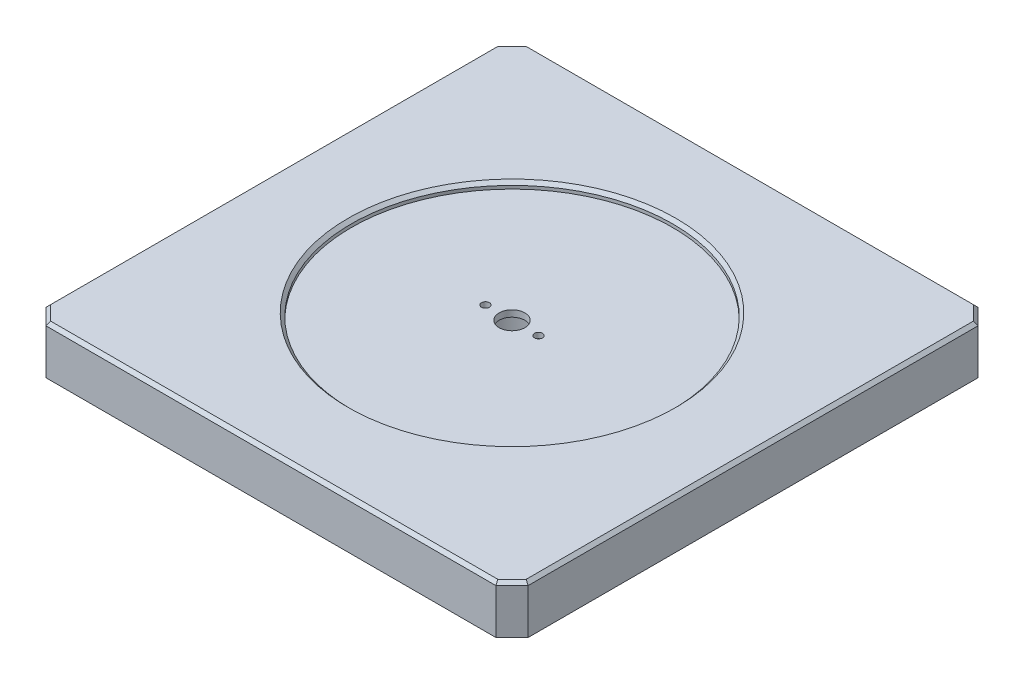
from build123d import *

# Parameters (mm, degrees)
SKETCH1_W                   = 150
SKETCH1_H                   = 150
BOSS_EXTRUDE1_DEPTH         = 15
SKETCH2_R                   = 12.5
CUT_EXTRUDE1_DEPTH          = 11
SKETCH3_R                   = 4
CUT_EXTRUDE2_DEPTH          = 107.6348911
SKETCH4_R                   = 50
CUT_EXTRUDE3_DEPTH          = 2
M3_TAPPED_HOLE1_D           = 2.5
M3_TAPPED_HOLE1_DEPTH       = 7.5
M3_TAPPED_HOLE1_CSINK_D     = 3.05
M3_TAPPED_HOLE1_CSINK_ANGLE = 90
M3_TAPPED_HOLE1_TIP         = 0.751075774
CHAMFER2_SIZE               = 5
CHAMFER1_SIZE               = 1


with BuildPart() as part:
    # Sketch1 → Boss-Extrude1 (new body)
    with BuildSketch(Plane(origin=(0, 0, 0), x_dir=(1, 0, 0), z_dir=(0, 1, 0))):
        Rectangle(SKETCH1_W, SKETCH1_H)
    extrude(amount=BOSS_EXTRUDE1_DEPTH)

    # Sketch2 → Cut-Extrude1 (cut)
    with BuildSketch(Plane(origin=(0, 0, 0), x_dir=(-1, 0, 0), z_dir=(0, -1, 0))):
        with Locations(Location((0, 0, 0), (0, 0, 90))):
            Circle(SKETCH2_R)
    extrude(amount=-CUT_EXTRUDE1_DEPTH, mode=Mode.SUBTRACT)

    # Sketch3 → Cut-Extrude2 (cut, through all)
    with BuildSketch(Plane(origin=(0, 11, 0), x_dir=(-1, 0, 0), z_dir=(0, -1, 0))):
        with Locations(Location((0, 0, 0), (0, 0, 90))):
            Circle(SKETCH3_R)
    extrude(amount=-CUT_EXTRUDE2_DEPTH, mode=Mode.SUBTRACT)

    # Sketch4 → Cut-Extrude3 (cut)
    with BuildSketch(Plane(origin=(0, 15, 0), x_dir=(1, 0, 0), z_dir=(0, 1, 0))):
        with Locations(Location((0, 0, 0), (0, 0, 270))):
            Circle(SKETCH4_R)
    extrude(amount=-CUT_EXTRUDE3_DEPTH, mode=Mode.SUBTRACT)

    # M3 Tapped Hole1
    with Locations(Plane(origin=(8.25, 11, 0), x_dir=(0, 0, -1), z_dir=(0, -1, 0))):
        with Locations((0, 0), (0, -16.5)):
            CounterSinkHole(M3_TAPPED_HOLE1_D / 2, M3_TAPPED_HOLE1_CSINK_D / 2, depth=M3_TAPPED_HOLE1_DEPTH, counter_sink_angle=M3_TAPPED_HOLE1_CSINK_ANGLE)
            with Locations((0, 0, -(M3_TAPPED_HOLE1_DEPTH + M3_TAPPED_HOLE1_TIP / 2))):  # 118° drill point
                Cone(0, M3_TAPPED_HOLE1_D / 2, M3_TAPPED_HOLE1_TIP, mode=Mode.SUBTRACT)

    # Chamfer2
    chamfer2_edges = [part.edges().sort_by_distance(p)[0] for p in [
        (75, 7.5, 75),
        (-75, 7.5, 75),
        (-75, 7.5, -75),
        (75, 7.5, -75),
    ]]
    chamfer(chamfer2_edges, length=CHAMFER2_SIZE)

    # Chamfer1
    chamfer1_edges = [part.edges().sort_by_distance(p)[0] for p in [
        (0, 15, -50),
        (0, 15, -75),
        (75, 15, 0),
        (-75, 15, 0),
        (0, 15, 75),
        (-72.5, 15, -72.5),
        (-72.5, 15, 72.5),
        (72.5, 15, 72.5),
        (72.5, 15, -72.5),
    ]]
    chamfer(chamfer1_edges, length=CHAMFER1_SIZE)


solid = part.part
